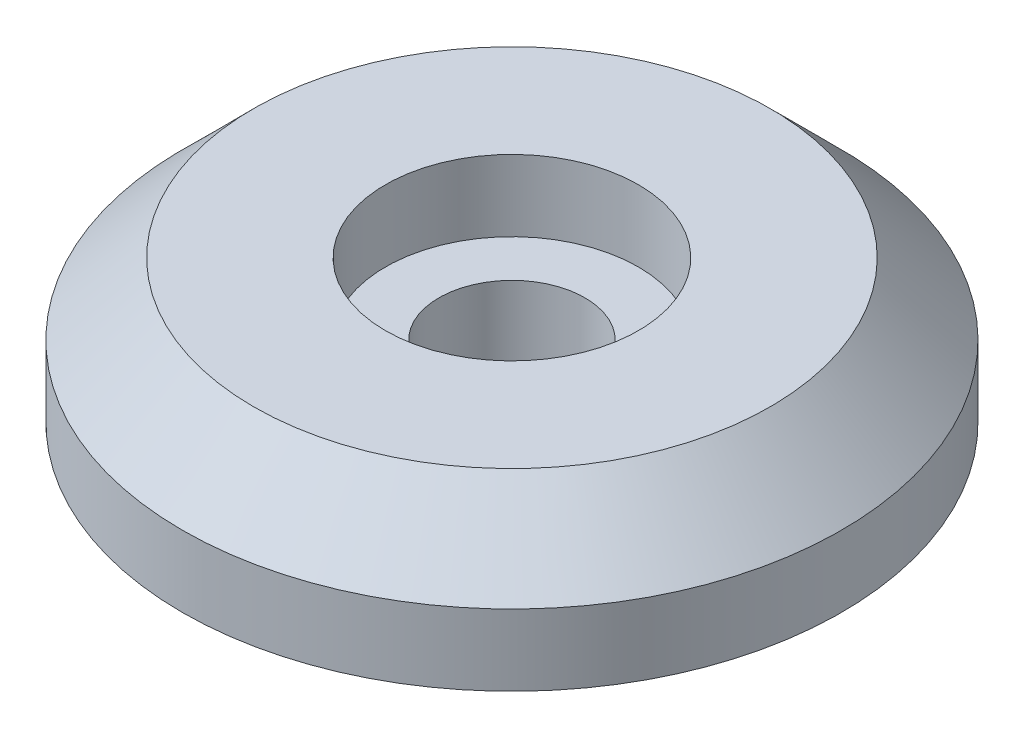
from build123d import *

# Parameters (mm, degrees)
SKETCH1_R           = 9.25
SKETCH1_R_2         = 2.05
BOSS_EXTRUDE1_DEPTH = 4
SKETCH2_R           = 3.55
CUT_EXTRUDE1_DEPTH  = 2
CHAMFER1_SIZE       = 2


with BuildPart() as part:
    # Sketch1 → Boss-Extrude1 (new body)
    with BuildSketch(Plane(origin=(0, 0, 0), x_dir=(1, 0, 0), z_dir=(0, 1, 0))):
        with Locations(Location((0, 0, 0), (0, 0, 270))):
            Circle(SKETCH1_R)
        with Locations(Location((0, 0, 0), (0, 0, 270))):
            Circle(SKETCH1_R_2, mode=Mode.SUBTRACT)
    extrude(amount=BOSS_EXTRUDE1_DEPTH)

    # Sketch2 → Cut-Extrude1 (cut)
    with BuildSketch(Plane(origin=(0, 4, 0), x_dir=(1, 0, 0), z_dir=(0, 1, 0))):
        with Locations(Location((0, 0, 0), (0, 0, 270))):
            Circle(SKETCH2_R)
    extrude(amount=-CUT_EXTRUDE1_DEPTH, mode=Mode.SUBTRACT)

    # Chamfer1
    chamfer1_edges = [part.edges().sort_by_distance(p)[0] for p in [
        (0, 4, -9.25),
    ]]
    chamfer(chamfer1_edges, length=CHAMFER1_SIZE)


solid = part.part
